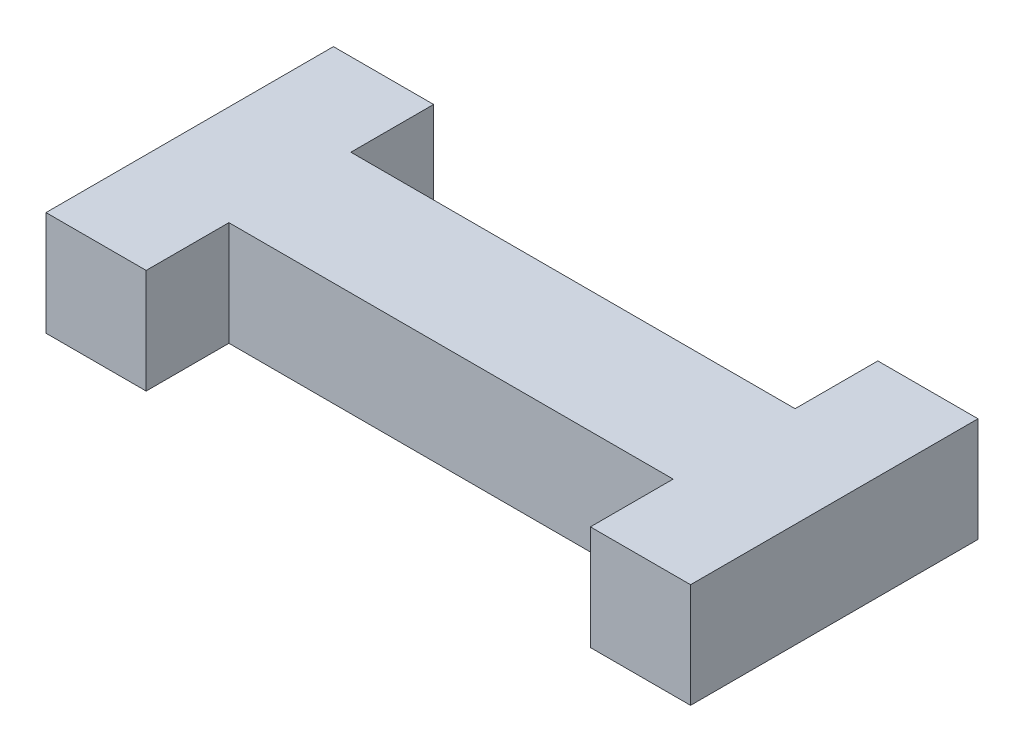
from build123d import *

# Parameters (mm, degrees)
BOSS_EXTRUDE1_DEPTH = 6.096


with BuildPart() as part:
    # Sketch1 → Boss-Extrude1 (new body)
    with BuildSketch(Plane(origin=(0, 0, 0), x_dir=(1, 0, 0), z_dir=(0, 1, 0))):
        Polygon((12.954, 3.556), (-12.954, 3.556), (-12.954, 8.382), (-18.796, 8.382), (-18.796, -8.382), (-12.954, -8.382), (-12.954, -3.556), (12.954, -3.556), (12.954, -8.382), (18.796, -8.382), (18.796, 8.382), (12.954, 8.382), align=None)
    extrude(amount=BOSS_EXTRUDE1_DEPTH)


solid = part.part
